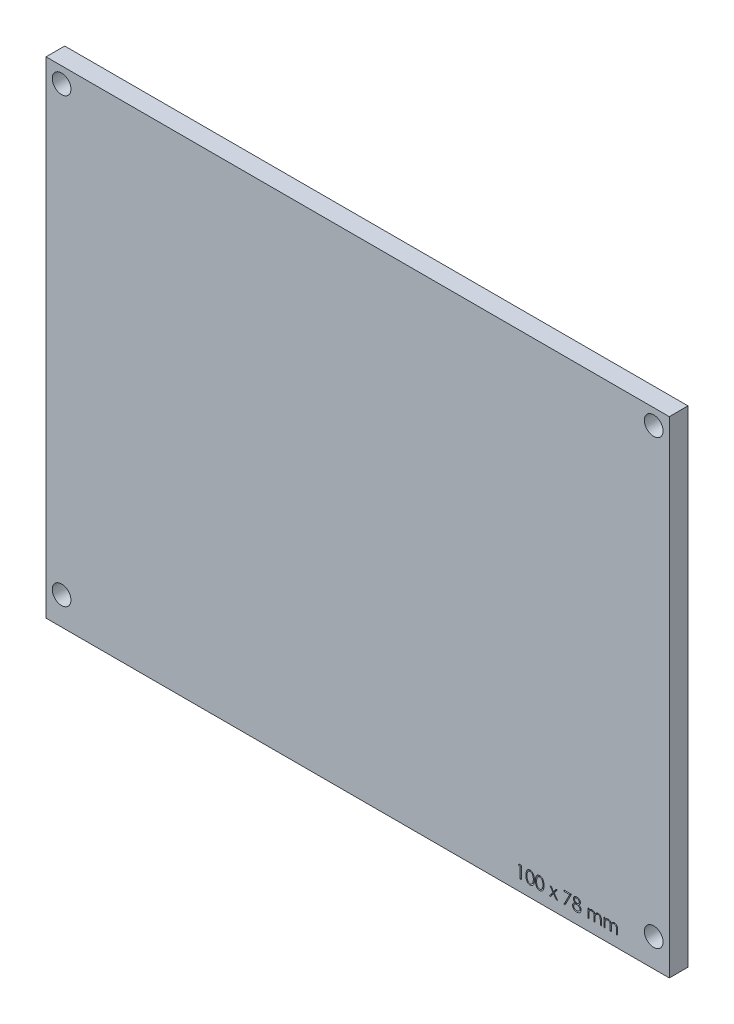
from build123d import *

# Parameters (mm, degrees)
SKETCH1_W               = 100
SKETCH1_H               = 78
BOSS_EXTRUDE1_DEPTH     = 3
CUT_EXTRUDE1_DEPTH      = 64.482280992
CUT_EXTRUDE1_DEPTH_BACK = 64.482280992
SKETCH2_R               = 1.5
CUT_EXTRUDE2_DEPTH      = 1


with BuildPart() as part:
    # Sketch1 → Boss-Extrude1 (new body)
    with BuildSketch(Plane.XY):
        Rectangle(SKETCH1_W, SKETCH1_H)
    extrude(amount=BOSS_EXTRUDE1_DEPTH)

    # Sketch2 → Cut-Extrude1 (cut, two sides: drawn at the far end of the back side and taken through both)
    with BuildSketch(Plane.XY.offset(3).offset(-CUT_EXTRUDE1_DEPTH_BACK)):
        with Locations((-47.5, 36.5)):
            Circle(SKETCH2_R)
        with Locations((47.5, 36.5)):
            Circle(SKETCH2_R)
        with Locations((47.5, -34.5)):
            Circle(SKETCH2_R)
        with Locations((-47.5, -34.5)):
            Circle(SKETCH2_R)
    extrude(amount=CUT_EXTRUDE1_DEPTH + CUT_EXTRUDE1_DEPTH_BACK, mode=Mode.SUBTRACT)

    # Sketch4 → Cut-Extrude2 (cut)
    # profile 1 of 8: a face of its own
    with BuildSketch(Plane.XY.offset(3)):
        Polygon((25.888230408, -35.213331847), (26.258022075, -35.213331847), (26.258022075, -37.213331847), (26.078534895, -37.213331847), (26.078534895, -35.418460052), (25.770842588, -35.418460052), align=None)
    # profile 2 of 8: a face of its own
    with BuildSketch(Plane.XY.offset(3)):
        with BuildLine():
            add(Edge.make_bspline(
                [(27.001611819, -36.214133129), (27.001799258, -36.182077479), (27.00216336, -36.119808916), (27.006213887, -36.029074835), (27.012942654, -35.94395467), (27.02216401, -35.864444347), (27.033385713, -35.790523338), (27.048365991, -35.722389191), (27.065401878, -35.659726559), (27.085146133, -35.602331103), (27.107424869, -35.549429558), (27.131673018, -35.500043729), (27.158852901, -35.454248339), (27.187411137, -35.411312459), (27.218503749, -35.371938919), (27.251245915, -35.335571683), (27.286915559, -35.303051254), (27.324300135, -35.273424796), (27.363738114, -35.247453669), (27.404105352, -35.224577819), (27.445679698, -35.205035037), (27.48857466, -35.189669074), (27.532404693, -35.176977161), (27.577323017, -35.168297763), (27.623403796, -35.162836672), (27.654507473, -35.162314576), (27.67028169, -35.162049796)],
                knots=[0, 0, 0, 0, 1.646270934, 3.197905019, 4.663502075, 6.030701355, 7.308322542, 8.50163776, 9.611534131, 10.641858119, 11.616356847, 12.558055219, 13.465016945, 14.349605745, 15.204443733, 16.039544428, 16.859896111, 17.680448484, 18.487036065, 19.28249412, 20.06191084, 20.843045899, 21.620316918, 22.403196591, 23.190181807, 24, 24, 24, 24], degree=3))
            add(Edge.make_bspline(
                [(27.67028169, -35.162049796), (27.686187678, -35.162328547), (27.717819683, -35.162882896), (27.764585612, -35.168210863), (27.810271144, -35.177051505), (27.854681509, -35.189577776), (27.898181502, -35.205118163), (27.940430877, -35.224596516), (27.981692067, -35.247270154), (28.021309374, -35.27391237), (28.059717726, -35.303616528), (28.095973704, -35.337195196), (28.130080611, -35.374309321), (28.162466499, -35.414561814), (28.192212555, -35.45872472), (28.220540231, -35.506029926), (28.24589568, -35.557304706), (28.270315494, -35.611693544), (28.291393772, -35.670701349), (28.310403055, -35.733995498), (28.325762466, -35.802323605), (28.338556336, -35.875327174), (28.348467705, -35.953274307), (28.355686357, -36.035997916), (28.359499549, -36.123552425), (28.360217664, -36.183414053), (28.360586178, -36.214133129)],
                knots=[0, 0, 0, 0, 0.810914788, 1.612654377, 2.396697861, 3.181598691, 3.963628158, 4.749916497, 5.551656086, 6.361998678, 7.18212741, 8.025565596, 8.878627764, 9.750805457, 10.657531673, 11.591944965, 12.560506719, 13.57287815, 14.630710178, 15.753379473, 16.941251878, 18.199788006, 19.531962791, 20.947069417, 22.433333509, 24, 24, 24, 24], degree=3))
            add(Edge.make_bspline(
                [(28.360586178, -36.214133129), (28.360213844, -36.244718219), (28.359488366, -36.30431202), (28.355729105, -36.391472578), (28.348324173, -36.473757174), (28.339061322, -36.551363152), (28.326232201, -36.623967506), (28.31045782, -36.691821477), (28.29294335, -36.755218089), (28.271323467, -36.813637981), (28.247660204, -36.867896109), (28.221914378, -36.918563051), (28.19433162, -36.966086646), (28.164280909, -37.010086502), (28.132250387, -37.050874306), (28.097554508, -37.08773009), (28.061171316, -37.121541903), (28.022649936, -37.151628547), (27.982414763, -37.177962721), (27.941295291, -37.201513493), (27.898561929, -37.220503604), (27.855183099, -37.236809342), (27.810538318, -37.249266743), (27.764683238, -37.257880375), (27.717851103, -37.263921431), (27.686193066, -37.264382277), (27.67028169, -37.264613898)],
                knots=[0, 0, 0, 0, 1.561518951, 3.042555995, 4.452378317, 5.7783523, 7.031515105, 8.214008947, 9.334062868, 10.386615937, 11.391082383, 12.354592575, 13.286541444, 14.194233754, 15.072674879, 15.931287219, 16.775624067, 17.606195743, 18.42308326, 19.229000347, 20.022332153, 20.807536673, 21.593273796, 22.3848459, 23.188221202, 24, 24, 24, 24], degree=3))
            add(Edge.make_bspline(
                [(27.67028169, -37.264613898), (27.654507911, -37.264347409), (27.623405097, -37.263821945), (27.577317997, -37.258385527), (27.532585172, -37.24964524), (27.488985884, -37.23740718), (27.446296446, -37.222427274), (27.405098568, -37.202910883), (27.364934178, -37.180434272), (27.325910431, -37.154836889), (27.288760625, -37.125510213), (27.253275708, -37.093073476), (27.220347125, -37.056717241), (27.189699071, -37.017015571), (27.16057102, -36.974333718), (27.133777093, -36.928088934), (27.108993748, -36.878464585), (27.086340324, -36.825140064), (27.066255374, -36.767337248), (27.048513826, -36.704394861), (27.034505736, -36.635757354), (27.022515476, -36.561976002), (27.0128444, -36.482733756), (27.006241929, -36.397987597), (27.002161177, -36.307790335), (27.00179828, -36.245921892), (27.001611819, -36.214133129)],
                knots=[0, 0, 0, 0, 0.810891512, 1.598919785, 2.382837074, 3.152667961, 3.926044502, 4.706494248, 5.493654104, 6.291793342, 7.103789334, 7.925228297, 8.761435821, 9.622817696, 10.50288917, 11.416980706, 12.369136599, 13.353924996, 14.394355917, 15.514179734, 16.714354668, 17.994756427, 19.357759367, 20.818452758, 22.365282078, 24, 24, 24, 24], degree=3))
        make_face()
        with BuildLine():
            add(Edge.make_bspline(
                [(27.181098998, -36.213331847), (27.181167254, -36.240045389), (27.181299724, -36.291891129), (27.18476041, -36.367230135), (27.189474828, -36.437498895), (27.19555557, -36.50278663), (27.204585826, -36.562872351), (27.21470399, -36.618169313), (27.227017184, -36.668384877), (27.241585766, -36.713863626), (27.258179536, -36.755377379), (27.276297172, -36.794006645), (27.295760442, -36.830207752), (27.317542814, -36.863655528), (27.341265707, -36.89445905), (27.366393284, -36.923163526), (27.393863332, -36.948761801), (27.431865471, -36.979462861), (27.482034885, -37.01118808), (27.545246573, -37.038814417), (27.610199974, -37.056175821), (27.654286403, -37.058383681), (27.676291306, -37.059485693)],
                knots=[0, 0, 0, 0, 1.459021318, 2.831673884, 4.118529203, 5.306027144, 6.411944654, 7.436330062, 8.375795394, 9.233974572, 10.042671642, 10.816086306, 11.563610507, 12.285937304, 12.993564865, 13.685989202, 14.367179055, 15.041617293, 16.353048772, 17.594441528, 18.799311195, 20, 20, 20, 20], degree=3))
            add(Edge.make_bspline(
                [(27.676291306, -37.059485693), (27.698438547, -37.058572675), (27.742687303, -37.056748525), (27.807335186, -37.039149247), (27.87009534, -37.012595224), (27.919279306, -36.98119665), (27.956697902, -36.951294747), (27.983507611, -36.925800662), (28.008114496, -36.897254453), (28.031452824, -36.866454855), (28.05285801, -36.832813435), (28.07232266, -36.796491964), (28.090084573, -36.757389576), (28.100204028, -36.730092583), (28.105377844, -36.716136334)],
                knots=[0, 0, 0, 0, 1.353760809, 2.704726607, 4.075137775, 5.516104923, 6.260822281, 7.007110065, 7.778089737, 8.566572457, 9.372053459, 10.217411131, 11.088608312, 12, 12, 12, 12], degree=3))
            add(Edge.make_bspline(
                [(28.105377844, -36.716136334), (28.111407426, -36.698290769), (28.123650062, -36.662056618), (28.139428219, -36.605848817), (28.151854161, -36.546875809), (28.163033228, -36.485490028), (28.170663545, -36.42123877), (28.176805153, -36.354320836), (28.180422688, -36.284685772), (28.180871117, -36.237374349), (28.181098998, -36.213331847)],
                knots=[0, 0, 0, 0, 0.884706709, 1.796334032, 2.740027952, 3.714592787, 4.726048262, 5.777819803, 6.87074269, 8, 8, 8, 8], degree=3))
            add(Edge.make_bspline(
                [(28.181098998, -36.213331847), (28.180784604, -36.189293234), (28.180169583, -36.142268568), (28.177818733, -36.073401037), (28.171748119, -36.007990888), (28.165005765, -35.945756332), (28.155064496, -35.887041873), (28.144345749, -35.831355984), (28.129945056, -35.779388542), (28.114562328, -35.730325924), (28.096956387, -35.68472555), (28.077575968, -35.642374814), (28.05687782, -35.603069257), (28.03439654, -35.566916719), (28.010399006, -35.533755266), (27.984251835, -35.504249784), (27.956992194, -35.477485802), (27.918810945, -35.446935762), (27.868825636, -35.415786222), (27.806628124, -35.387120074), (27.741902041, -35.370658192), (27.698145782, -35.368337228), (27.676291306, -35.367178001)],
                knots=[0, 0, 0, 0, 1.31362396, 2.569729283, 3.763502607, 4.902122613, 5.988968491, 7.01645872, 7.998833611, 8.933434873, 9.825090667, 10.667526885, 11.477055099, 12.250526234, 12.991942729, 13.710640831, 14.402115721, 15.076753259, 16.378508321, 17.609869233, 18.806226677, 20, 20, 20, 20], degree=3))
            add(Edge.make_bspline(
                [(27.676291306, -35.367178001), (27.654170967, -35.368338827), (27.609889993, -35.370662596), (27.544491161, -35.38705874), (27.481802961, -35.415637578), (27.431949832, -35.447038934), (27.393741954, -35.47694654), (27.366837558, -35.502881657), (27.341611174, -35.531250945), (27.318372488, -35.562337754), (27.296607183, -35.595746535), (27.276618033, -35.631740115), (27.258608131, -35.670500894), (27.241988396, -35.711996), (27.227375374, -35.757470826), (27.215321681, -35.807624536), (27.204186222, -35.862745617), (27.196303211, -35.923156765), (27.189295351, -35.988460852), (27.184791723, -36.058905034), (27.181288147, -36.134370394), (27.181163311, -36.186484199), (27.181098998, -36.213331847)],
                knots=[0, 0, 0, 0, 1.207732386, 2.417664972, 3.655092373, 4.956220595, 5.625982001, 6.301752483, 6.994047911, 7.697131622, 8.419323945, 9.170223765, 9.943494443, 10.752040957, 11.610060368, 12.549350801, 13.567764191, 14.679664412, 15.874934091, 17.154273443, 18.533957287, 20, 20, 20, 20], degree=3))
        make_face(mode=Mode.SUBTRACT)
    # profile 3 of 8: a face of its own
    with BuildSketch(Plane.XY.offset(3)):
        with BuildLine():
            add(Edge.make_bspline(
                [(28.540073357, -36.214133129), (28.540260796, -36.182077479), (28.540624899, -36.119808916), (28.544675425, -36.029074835), (28.551404192, -35.94395467), (28.560625548, -35.864444347), (28.571847251, -35.790523338), (28.586827529, -35.722389191), (28.603863416, -35.659726559), (28.623607671, -35.602331103), (28.645886408, -35.549429558), (28.670134557, -35.500043729), (28.697314439, -35.454248339), (28.725872675, -35.411312459), (28.756965287, -35.371938919), (28.789707453, -35.335571683), (28.825377097, -35.303051254), (28.862761673, -35.273424796), (28.902199653, -35.247453669), (28.942566891, -35.224577819), (28.984141237, -35.205035037), (29.027036198, -35.189669074), (29.070866232, -35.176977161), (29.115784555, -35.168297763), (29.161865335, -35.162836672), (29.192969012, -35.162314576), (29.208743229, -35.162049796)],
                knots=[0, 0, 0, 0, 1.646270934, 3.197905019, 4.663502075, 6.030701355, 7.308322542, 8.50163776, 9.611534131, 10.641858119, 11.616356847, 12.558055219, 13.465016945, 14.349605745, 15.204443733, 16.039544428, 16.859896111, 17.680448484, 18.487036065, 19.28249412, 20.06191084, 20.843045899, 21.620316918, 22.403196591, 23.190181807, 24, 24, 24, 24], degree=3))
            add(Edge.make_bspline(
                [(29.208743229, -35.162049796), (29.224649217, -35.162328547), (29.256281222, -35.162882896), (29.30304715, -35.168210863), (29.348732683, -35.177051505), (29.393143048, -35.189577776), (29.43664304, -35.205118163), (29.478892416, -35.224596516), (29.520153605, -35.247270154), (29.559770912, -35.27391237), (29.598179264, -35.303616528), (29.634435243, -35.337195196), (29.668542149, -35.374309321), (29.700928038, -35.414561814), (29.730674093, -35.45872472), (29.759001769, -35.506029926), (29.784357218, -35.557304706), (29.808777032, -35.611693544), (29.829855311, -35.670701349), (29.848864594, -35.733995498), (29.864224004, -35.802323605), (29.877017874, -35.875327174), (29.886929243, -35.953274307), (29.894147896, -36.035997916), (29.897961087, -36.123552425), (29.898679202, -36.183414053), (29.899047716, -36.214133129)],
                knots=[0, 0, 0, 0, 0.810914788, 1.612654377, 2.396697861, 3.181598691, 3.963628158, 4.749916497, 5.551656086, 6.361998678, 7.18212741, 8.025565596, 8.878627764, 9.750805457, 10.657531673, 11.591944965, 12.560506719, 13.57287815, 14.630710178, 15.753379473, 16.941251878, 18.199788006, 19.531962791, 20.947069417, 22.433333509, 24, 24, 24, 24], degree=3))
            add(Edge.make_bspline(
                [(29.899047716, -36.214133129), (29.898675382, -36.244718219), (29.897949904, -36.30431202), (29.894190643, -36.391472578), (29.886785711, -36.473757174), (29.877522861, -36.551363152), (29.864693739, -36.623967506), (29.848919358, -36.691821477), (29.831404888, -36.755218089), (29.809785006, -36.813637981), (29.786121743, -36.867896109), (29.760375916, -36.918563051), (29.732793159, -36.966086646), (29.702742447, -37.010086502), (29.670711925, -37.050874306), (29.636016046, -37.08773009), (29.599632855, -37.121541903), (29.561111474, -37.151628547), (29.520876302, -37.177962721), (29.479756829, -37.201513493), (29.437023467, -37.220503604), (29.393644637, -37.236809342), (29.348999857, -37.249266743), (29.303144776, -37.257880375), (29.256312641, -37.263921431), (29.224654604, -37.264382277), (29.208743229, -37.264613898)],
                knots=[0, 0, 0, 0, 1.561518951, 3.042555995, 4.452378317, 5.7783523, 7.031515105, 8.214008947, 9.334062868, 10.386615937, 11.391082383, 12.354592575, 13.286541444, 14.194233754, 15.072674879, 15.931287219, 16.775624067, 17.606195743, 18.42308326, 19.229000347, 20.022332153, 20.807536673, 21.593273796, 22.3848459, 23.188221202, 24, 24, 24, 24], degree=3))
            add(Edge.make_bspline(
                [(29.208743229, -37.264613898), (29.192969449, -37.264347409), (29.161866635, -37.263821945), (29.115779535, -37.258385527), (29.07104671, -37.24964524), (29.027447422, -37.23740718), (28.984757985, -37.222427274), (28.943560107, -37.202910883), (28.903395716, -37.180434272), (28.86437197, -37.154836889), (28.827222164, -37.125510213), (28.791737246, -37.093073476), (28.758808664, -37.056717241), (28.728160609, -37.017015571), (28.699032559, -36.974333718), (28.672238631, -36.928088934), (28.647455286, -36.878464585), (28.624801863, -36.825140064), (28.604716912, -36.767337248), (28.586975365, -36.704394861), (28.572967275, -36.635757354), (28.560977015, -36.561976002), (28.551305939, -36.482733756), (28.544703467, -36.397987597), (28.540622716, -36.307790335), (28.540259818, -36.245921892), (28.540073357, -36.214133129)],
                knots=[0, 0, 0, 0, 0.810891512, 1.598919785, 2.382837074, 3.152667961, 3.926044502, 4.706494248, 5.493654104, 6.291793342, 7.103789334, 7.925228297, 8.761435821, 9.622817696, 10.50288917, 11.416980706, 12.369136599, 13.353924996, 14.394355917, 15.514179734, 16.714354668, 17.994756427, 19.357759367, 20.818452758, 22.365282078, 24, 24, 24, 24], degree=3))
        make_face()
        with BuildLine():
            add(Edge.make_bspline(
                [(28.719560537, -36.213331847), (28.719628792, -36.240045389), (28.719761262, -36.291891129), (28.723221948, -36.367230135), (28.727936367, -36.437498895), (28.734017108, -36.50278663), (28.743047364, -36.562872351), (28.753165529, -36.618169313), (28.765478723, -36.668384877), (28.780047304, -36.713863626), (28.796641074, -36.755377379), (28.814758711, -36.794006645), (28.834221981, -36.830207752), (28.856004352, -36.863655528), (28.879727246, -36.89445905), (28.904854822, -36.923163526), (28.932324871, -36.948761801), (28.970327009, -36.979462861), (29.020496423, -37.01118808), (29.083708112, -37.038814417), (29.148661512, -37.056175821), (29.192747941, -37.058383681), (29.214752844, -37.059485693)],
                knots=[0, 0, 0, 0, 1.459021318, 2.831673884, 4.118529203, 5.306027144, 6.411944654, 7.436330062, 8.375795394, 9.233974572, 10.042671642, 10.816086306, 11.563610507, 12.285937304, 12.993564865, 13.685989202, 14.367179055, 15.041617293, 16.353048772, 17.594441528, 18.799311195, 20, 20, 20, 20], degree=3))
            add(Edge.make_bspline(
                [(29.214752844, -37.059485693), (29.236900085, -37.058572675), (29.281148841, -37.056748525), (29.345796724, -37.039149247), (29.408556879, -37.012595224), (29.457740844, -36.98119665), (29.495159441, -36.951294747), (29.521969149, -36.925800662), (29.546576034, -36.897254453), (29.569914363, -36.866454855), (29.591319549, -36.832813435), (29.610784199, -36.796491964), (29.628546112, -36.757389576), (29.638665567, -36.730092583), (29.643839383, -36.716136334)],
                knots=[0, 0, 0, 0, 1.353760809, 2.704726607, 4.075137775, 5.516104923, 6.260822281, 7.007110065, 7.778089737, 8.566572457, 9.372053459, 10.217411131, 11.088608312, 12, 12, 12, 12], degree=3))
            add(Edge.make_bspline(
                [(29.643839383, -36.716136334), (29.649868964, -36.698290769), (29.662111601, -36.662056618), (29.677889757, -36.605848817), (29.6903157, -36.546875809), (29.701494766, -36.485490028), (29.709125084, -36.42123877), (29.715266691, -36.354320836), (29.718884227, -36.284685772), (29.719332656, -36.237374349), (29.719560537, -36.213331847)],
                knots=[0, 0, 0, 0, 0.884706709, 1.796334032, 2.740027952, 3.714592787, 4.726048262, 5.777819803, 6.87074269, 8, 8, 8, 8], degree=3))
            add(Edge.make_bspline(
                [(29.719560537, -36.213331847), (29.719246143, -36.189293234), (29.718631121, -36.142268568), (29.716280271, -36.073401037), (29.710209657, -36.007990888), (29.703467303, -35.945756332), (29.693526034, -35.887041873), (29.682807287, -35.831355984), (29.668406595, -35.779388542), (29.653023866, -35.730325924), (29.635417926, -35.68472555), (29.616037506, -35.642374814), (29.595339358, -35.603069257), (29.572858078, -35.566916719), (29.548860545, -35.533755266), (29.522713374, -35.504249784), (29.495453732, -35.477485802), (29.457272483, -35.446935762), (29.407287175, -35.415786222), (29.345089662, -35.387120074), (29.28036358, -35.370658192), (29.23660732, -35.368337228), (29.214752844, -35.367178001)],
                knots=[0, 0, 0, 0, 1.31362396, 2.569729283, 3.763502607, 4.902122613, 5.988968491, 7.01645872, 7.998833611, 8.933434873, 9.825090667, 10.667526885, 11.477055099, 12.250526234, 12.991942729, 13.710640831, 14.402115721, 15.076753259, 16.378508321, 17.609869233, 18.806226677, 20, 20, 20, 20], degree=3))
            add(Edge.make_bspline(
                [(29.214752844, -35.367178001), (29.192632506, -35.368338827), (29.148351531, -35.370662596), (29.0829527, -35.38705874), (29.020264499, -35.415637578), (28.970411371, -35.447038934), (28.932203493, -35.47694654), (28.905299096, -35.502881657), (28.880072712, -35.531250945), (28.856834026, -35.562337754), (28.835068722, -35.595746535), (28.815079572, -35.631740115), (28.797069669, -35.670500894), (28.780449934, -35.711996), (28.765836912, -35.757470826), (28.753783219, -35.807624536), (28.74264776, -35.862745617), (28.734764749, -35.923156765), (28.727756889, -35.988460852), (28.723253262, -36.058905034), (28.719749686, -36.134370394), (28.719624849, -36.186484199), (28.719560537, -36.213331847)],
                knots=[0, 0, 0, 0, 1.207732386, 2.417664972, 3.655092373, 4.956220595, 5.625982001, 6.301752483, 6.994047911, 7.697131622, 8.419323945, 9.170223765, 9.943494443, 10.752040957, 11.610060368, 12.549350801, 13.567764191, 14.679664412, 15.874934091, 17.154273443, 18.533957287, 20, 20, 20, 20], degree=3))
        make_face(mode=Mode.SUBTRACT)
    # profile 4 of 8: a face of its own
    with BuildSketch(Plane.XY.offset(3)):
        Polygon((30.847765665, -35.751793385), (31.061307331, -35.751793385), (31.437509254, -36.279036975), (31.813711178, -35.751793385), (32.027252844, -35.751793385), (31.544480408, -36.428476078), (32.104175921, -37.213331847), (31.890634254, -37.213331847), (31.437509254, -36.578315821), (30.984384254, -37.213331847), (30.770842588, -37.213331847), (31.330938742, -36.428476078), align=None)
    # profile 5 of 8: a face of its own
    with BuildSketch(Plane.XY.offset(3)):
        Polygon((33.078534895, -35.213331847), (34.309304126, -35.213331847), (33.258022075, -37.264613898), (33.102973998, -37.17927736), (34.005618229, -35.418460052), (33.078534895, -35.418460052), align=None)
    # profile 6 of 8: a face of its own
    with BuildSketch(Plane.XY.offset(3)):
        with BuildLine():
            add(Edge.make_bspline(
                [(35.461147075, -36.099149155), (35.477517673, -36.107685129), (35.509445807, -36.124333131), (35.554918498, -36.151139318), (35.596475641, -36.179391298), (35.635270248, -36.207754647), (35.670620734, -36.23731559), (35.702131827, -36.268191679), (35.730581896, -36.29961222), (35.755397201, -36.332109271), (35.777223965, -36.365596499), (35.796088042, -36.400161798), (35.812212158, -36.435729417), (35.82499098, -36.472687606), (35.835517718, -36.51049347), (35.842760921, -36.549635174), (35.846656303, -36.589854797), (35.847392768, -36.617036684), (35.847765665, -36.630799796)],
                knots=[0, 0, 0, 0, 1.272397273, 2.481599622, 3.635517121, 4.734568067, 5.792894095, 6.808321871, 7.773003508, 8.711915296, 9.623354172, 10.525449501, 11.423591555, 12.311487226, 13.218079475, 14.126165749, 15.051214107, 16, 16, 16, 16], degree=3))
            add(Edge.make_bspline(
                [(35.847765665, -36.630799796), (35.847324853, -36.650055643), (35.846452321, -36.68817019), (35.83885233, -36.74442511), (35.827473485, -36.799060414), (35.810856621, -36.852064123), (35.789306112, -36.903143765), (35.76274792, -36.952343064), (35.732684374, -37.000468384), (35.708540238, -37.030079471), (35.696323357, -37.045062616)],
                knots=[0, 0, 0, 0, 1.025265484, 2.029385089, 3.018602448, 3.995076438, 4.983346944, 5.966715145, 6.97116228, 8, 8, 8, 8], degree=3))
            add(Edge.make_bspline(
                [(35.696323357, -37.045062616), (35.6804168, -37.062544773), (35.648800249, -37.097293054), (35.594638576, -37.142407803), (35.535197499, -37.180321742), (35.470707023, -37.211219968), (35.401339537, -37.23526903), (35.32710982, -37.252550469), (35.247873161, -37.262449), (35.193412892, -37.263879851), (35.165473998, -37.264613898)],
                knots=[0, 0, 0, 0, 0.954267603, 1.896743057, 2.838368354, 3.796610408, 4.779680527, 5.799409237, 6.871065594, 8, 8, 8, 8], degree=3))
            add(Edge.make_bspline(
                [(35.165473998, -37.264613898), (35.138609205, -37.263955339), (35.086333045, -37.262673851), (35.010242829, -37.253991318), (34.939315361, -37.238775395), (34.873138236, -37.217949904), (34.812110411, -37.190858345), (34.756405782, -37.157139254), (34.705220655, -37.118149858), (34.660108385, -37.072770385), (34.620057845, -37.024165887), (34.584876101, -36.97402211), (34.55563377, -36.922334477), (34.53087543, -36.869873695), (34.511922274, -36.815904465), (34.498795297, -36.760704457), (34.490458546, -36.70437009), (34.489349326, -36.666352002), (34.488791306, -36.647226078)],
                knots=[0, 0, 0, 0, 1.256902934, 2.445805442, 3.576955095, 4.645999104, 5.686449165, 6.692658513, 7.68621702, 8.689161843, 9.678783111, 10.630372946, 11.551080876, 12.453998257, 13.34127905, 14.221779781, 15.105423033, 16, 16, 16, 16], degree=3))
            add(Edge.make_bspline(
                [(34.488791306, -36.647226078), (34.489121523, -36.633192254), (34.48977415, -36.605456464), (34.494291206, -36.564479705), (34.501553184, -36.524596199), (34.511415731, -36.485658632), (34.524782032, -36.447950476), (34.540920394, -36.411293062), (34.559738652, -36.375645006), (34.581499318, -36.34081136), (34.60681476, -36.30728021), (34.635479703, -36.274482498), (34.668067056, -36.242927146), (34.70421429, -36.212228617), (34.743508313, -36.181842347), (34.786969759, -36.153410502), (34.833446483, -36.124920236), (34.866478143, -36.107886907), (34.883422716, -36.099149155)],
                knots=[0, 0, 0, 0, 0.941657376, 1.861047343, 2.762797495, 3.66048619, 4.553285746, 5.444104102, 6.34607688, 7.256116206, 8.197091036, 9.162375105, 10.176350973, 11.237807142, 12.343728897, 13.50695164, 14.721116704, 16, 16, 16, 16], degree=3))
            add(Edge.make_bspline(
                [(34.883422716, -36.099149155), (34.860227645, -36.086500715), (34.815315495, -36.062009797), (34.755847242, -36.017011622), (34.704766886, -35.968275728), (34.663478476, -35.914772988), (34.63098006, -35.858174774), (34.608683715, -35.798835201), (34.593600009, -35.737854565), (34.592105823, -35.696193881), (34.591355408, -35.67527095)],
                knots=[0, 0, 0, 0, 1.166880483, 2.259407225, 3.286803203, 4.280235371, 5.237608625, 6.161067461, 7.076446754, 8, 8, 8, 8], degree=3))
            add(Edge.make_bspline(
                [(34.591355408, -35.67527095), (34.592289936, -35.653958059), (34.594168501, -35.611115432), (34.60935897, -35.547340505), (34.634113293, -35.484702467), (34.667782435, -35.423504917), (34.709717987, -35.36581908), (34.760030298, -35.314081397), (34.817517897, -35.26876055), (34.881893821, -35.230717022), (34.95117167, -35.199754932), (35.024266369, -35.178395833), (35.099904365, -35.164432338), (35.151388776, -35.162851392), (35.177493229, -35.162049796)],
                knots=[0, 0, 0, 0, 0.888701115, 1.786444228, 2.72001202, 3.692817113, 4.693886446, 5.687152267, 6.695133018, 7.739871481, 8.800368666, 9.853104506, 10.91144658, 12, 12, 12, 12], degree=3))
            add(Edge.make_bspline(
                [(35.177493229, -35.162049796), (35.20292398, -35.162876277), (35.253070525, -35.164506005), (35.326781741, -35.178098507), (35.397310242, -35.20080109), (35.464412813, -35.231599503), (35.526888166, -35.269534898), (35.582089485, -35.315478255), (35.630850961, -35.366987712), (35.6711849, -35.424656057), (35.704420837, -35.485618453), (35.727564209, -35.549402751), (35.742393909, -35.614630784), (35.744264402, -35.658766787), (35.745201562, -35.680879924)],
                knots=[0, 0, 0, 0, 1.072916533, 2.115669174, 3.151510826, 4.193348718, 5.225979165, 6.227137561, 7.216255879, 8.211077061, 9.189680878, 10.138522389, 11.067357538, 12, 12, 12, 12], degree=3))
            add(Edge.make_bspline(
                [(35.745201562, -35.680879924), (35.744381813, -35.702580875), (35.742771873, -35.745200309), (35.72922905, -35.807329749), (35.706421443, -35.865513771), (35.675281921, -35.920412601), (35.634695928, -35.9710306), (35.585205223, -36.018011439), (35.527204379, -36.061741056), (35.483626729, -36.086418978), (35.461147075, -36.099149155)],
                knots=[0, 0, 0, 0, 0.975232327, 1.915300861, 2.843280834, 3.77672583, 4.742871857, 5.749627742, 6.839139064, 8, 8, 8, 8], degree=3))
        make_face()
        with BuildLine():
            add(Edge.make_bspline(
                [(35.167477203, -35.367178001), (35.153448171, -35.367550253), (35.126001251, -35.36827854), (35.085756296, -35.372083475), (35.047486371, -35.379485313), (35.010791628, -35.389336006), (34.976175164, -35.402643427), (34.943166847, -35.418297718), (34.912328453, -35.437329756), (34.883287709, -35.458679012), (34.857144409, -35.482160672), (34.833941808, -35.506625655), (34.8146686, -35.53255445), (34.798302251, -35.559302084), (34.786427099, -35.587662413), (34.777533211, -35.616765943), (34.771520987, -35.646980448), (34.771070478, -35.667629883), (34.770842588, -35.678075437)],
                knots=[0, 0, 0, 0, 1.203892937, 2.355340988, 3.463153438, 4.544400666, 5.610487187, 6.640501085, 7.674077295, 8.714426146, 9.728707835, 10.68524104, 11.601827946, 12.495867327, 13.368432065, 14.231010473, 15.105153427, 16, 16, 16, 16], degree=3))
            add(Edge.make_bspline(
                [(34.770842588, -35.678075437), (34.771235369, -35.688521442), (34.772011561, -35.70916425), (34.778014491, -35.739647602), (34.786961265, -35.769602823), (34.801047357, -35.798317629), (34.817942419, -35.82678812), (34.838794691, -35.85430274), (34.863645564, -35.880957246), (34.891661245, -35.906524927), (34.922182123, -35.930467077), (34.954515862, -35.951251752), (34.988256657, -35.968642672), (35.02305784, -35.983116618), (35.059274096, -35.994368011), (35.096683509, -36.002350094), (35.135292367, -36.007311236), (35.161452699, -36.007903819), (35.174688742, -36.008203642)],
                knots=[0, 0, 0, 0, 0.873023192, 1.725219244, 2.590779336, 3.480155217, 4.391973325, 5.357036234, 6.360879153, 7.436073238, 8.526419356, 9.601555421, 10.645666583, 11.697338044, 12.750135903, 13.812665442, 14.89329948, 16, 16, 16, 16], degree=3))
            add(Edge.make_bspline(
                [(35.174688742, -36.008203642), (35.191688801, -36.007704861), (35.225521011, -36.006712225), (35.275394915, -35.997482982), (35.323887854, -35.982965315), (35.370481514, -35.963102477), (35.413969849, -35.938172272), (35.452735602, -35.908324833), (35.486448112, -35.874249349), (35.514757032, -35.8364763), (35.536705516, -35.796275392), (35.553792263, -35.755932368), (35.5637701, -35.715016807), (35.565071567, -35.687607113), (35.565714383, -35.674069026)],
                knots=[0, 0, 0, 0, 1.076279235, 2.141928126, 3.20205304, 4.278698113, 5.344010996, 6.36967002, 7.368914609, 8.37248503, 9.349703398, 10.264243087, 11.142681841, 12, 12, 12, 12], degree=3))
            add(Edge.make_bspline(
                [(35.565714383, -35.674069026), (35.565410441, -35.664567292), (35.564807161, -35.64570771), (35.5598357, -35.617857215), (35.551620939, -35.590640311), (35.540499179, -35.563832156), (35.52586501, -35.53780888), (35.508514046, -35.512161402), (35.487437188, -35.487466679), (35.463782083, -35.463149223), (35.436956135, -35.440644067), (35.407011043, -35.420852804), (35.374100328, -35.404045743), (35.338223214, -35.390395026), (35.299511829, -35.380142255), (35.258144472, -35.372464342), (35.213776216, -35.368136849), (35.18324493, -35.367504549), (35.167477203, -35.367178001)],
                knots=[0, 0, 0, 0, 0.814439003, 1.616544685, 2.417341072, 3.248991801, 4.09997495, 4.973547432, 5.9003056, 6.880240646, 7.880314356, 8.896779544, 9.951930927, 11.043077905, 12.18215768, 13.381699519, 14.647792085, 16, 16, 16, 16], degree=3))
        make_face(mode=Mode.SUBTRACT)
        with BuildLine():
            add(Edge.make_bspline(
                [(35.179095793, -36.213331847), (35.16130963, -36.213648213), (35.126417517, -36.214268847), (35.075299273, -36.221177133), (35.026240321, -36.230793929), (34.979406072, -36.24538298), (34.934816302, -36.264352403), (34.892229626, -36.28717214), (34.851971838, -36.314146679), (34.814598852, -36.344933316), (34.780471235, -36.378110147), (34.750529349, -36.413231367), (34.725102194, -36.449644243), (34.704626051, -36.487811231), (34.687819347, -36.526924152), (34.676782846, -36.567957063), (34.669707582, -36.610121128), (34.668757507, -36.638784041), (34.668278485, -36.653235693)],
                knots=[0, 0, 0, 0, 1.140299081, 2.23698856, 3.303958914, 4.344563908, 5.37730929, 6.408454204, 7.439741482, 8.480804886, 9.510774543, 10.48932336, 11.43758569, 12.353841022, 13.263987381, 14.161954604, 15.073269652, 16, 16, 16, 16], degree=3))
            add(Edge.make_bspline(
                [(34.668278485, -36.653235693), (34.66905749, -36.671196211), (34.670603018, -36.706829459), (34.682863954, -36.759494071), (34.702541403, -36.810477531), (34.729984384, -36.859364361), (34.763965854, -36.905050136), (34.805752407, -36.944872293), (34.852747171, -36.980255995), (34.906540231, -37.008873443), (34.965299354, -37.031727646), (35.029008914, -37.04747391), (35.096754582, -37.057897596), (35.143531491, -37.058947985), (35.167477203, -37.059485693)],
                knots=[0, 0, 0, 0, 0.898778495, 1.783155532, 2.693654817, 3.627872908, 4.583023416, 5.533784346, 6.509005473, 7.520592997, 8.575161974, 9.658835044, 10.801527049, 12, 12, 12, 12], degree=3))
            add(Edge.make_bspline(
                [(35.167477203, -37.059485693), (35.186191699, -37.059126374), (35.222653539, -37.058426305), (35.275845509, -37.052246708), (35.326042394, -37.042446923), (35.37314685, -37.028193468), (35.417686188, -37.010793482), (35.458905247, -36.988409435), (35.497864405, -36.962950965), (35.532643904, -36.932746304), (35.564320023, -36.900472307), (35.591939048, -36.866306568), (35.615914791, -36.831177635), (35.63473248, -36.794291644), (35.649776054, -36.756356264), (35.660589514, -36.717021686), (35.667261637, -36.676167267), (35.667936434, -36.648453512), (35.668278485, -36.634405565)],
                knots=[0, 0, 0, 0, 1.224942928, 2.386581632, 3.501229538, 4.569074225, 5.605009692, 6.626002462, 7.634866581, 8.645888296, 9.63523824, 10.59253846, 11.518950513, 12.414518923, 13.29783783, 14.186679152, 15.080837789, 16, 16, 16, 16], degree=3))
            add(Edge.make_bspline(
                [(35.668278485, -36.634405565), (35.667760857, -36.62076137), (35.666740186, -36.593857402), (35.660262077, -36.553990815), (35.648881575, -36.515474921), (35.63326592, -36.477846347), (35.612476799, -36.441867518), (35.587994016, -36.406601134), (35.558454519, -36.373026023), (35.525075893, -36.340881396), (35.488699344, -36.311158118), (35.450032404, -36.284864153), (35.409372711, -36.262720087), (35.366806305, -36.244710661), (35.322427702, -36.230546393), (35.276269543, -36.220651538), (35.228277786, -36.214423194), (35.195675002, -36.213699739), (35.179095793, -36.213331847)],
                knots=[0, 0, 0, 0, 0.917430815, 1.809013306, 2.70690318, 3.612392954, 4.541220862, 5.495268465, 6.494511384, 7.542276156, 8.608045339, 9.649016899, 10.681629292, 11.715607085, 12.752076957, 13.808767841, 14.885711793, 16, 16, 16, 16], degree=3))
        make_face(mode=Mode.SUBTRACT)
    # profile 7 of 8: a face of its own
    with BuildSketch(Plane.XY.offset(3)):
        with BuildLine():
            Line((36.924688742, -35.751793385), (37.104175921, -35.751793385))
            Line((37.104175921, -35.751793385), (37.104175921, -36.005799796))
            add(Edge.make_bspline(
                [(37.104175921, -36.005799796), (37.120338178, -35.983578309), (37.151306612, -35.94099981), (37.202086985, -35.884891076), (37.252816192, -35.837274988), (37.289349553, -35.812279061), (37.30690028, -35.80027095)],
                knots=[0, 0, 0, 0, 1.134379233, 2.173579362, 3.122582517, 4, 4, 4, 4], degree=3))
            add(Edge.make_bspline(
                [(37.30690028, -35.80027095), (37.330822944, -35.788839312), (37.378250315, -35.766175762), (37.453347015, -35.743185157), (37.530189684, -35.729056527), (37.582080092, -35.727124314), (37.608182331, -35.72615236)],
                knots=[0, 0, 0, 0, 1.014936303, 2.012140481, 3.000054389, 4, 4, 4, 4], degree=3))
            add(Edge.make_bspline(
                [(37.608182331, -35.72615236), (37.625835472, -35.726749669), (37.660770089, -35.727931711), (37.712532426, -35.73562316), (37.762737347, -35.748918116), (37.811088221, -35.767436587), (37.856642895, -35.789863265), (37.898408151, -35.816177384), (37.935907698, -35.84571857), (37.969122585, -35.879820817), (37.998990599, -35.919441731), (38.026464226, -35.965649873), (38.051850062, -36.019482822), (38.065919381, -36.058549417), (38.073326562, -36.079117103)],
                knots=[0, 0, 0, 0, 1.009824226, 1.998387844, 2.986035974, 3.974953746, 4.955485308, 5.885931332, 6.793869504, 7.679848016, 8.601185859, 9.625726857, 10.749998409, 12, 12, 12, 12], degree=3))
            add(Edge.make_bspline(
                [(38.073326562, -36.079117103), (38.081161563, -36.064988864), (38.096579744, -36.037186472), (38.12246868, -35.997838894), (38.149593135, -35.961035013), (38.178184274, -35.926745628), (38.20814118, -35.895140067), (38.239604838, -35.866113838), (38.272396141, -35.839542287), (38.317991707, -35.808500482), (38.377313197, -35.775528378), (38.452106405, -35.746940696), (38.529906503, -35.729274337), (38.582716617, -35.727199895), (38.609384254, -35.72615236)],
                knots=[0, 0, 0, 0, 0.86119277, 1.694706429, 2.50939023, 3.298075842, 4.073795165, 4.829715201, 5.57930267, 6.321991688, 7.768977793, 9.186738141, 10.579381044, 12, 12, 12, 12], degree=3))
            add(Edge.make_bspline(
                [(38.609384254, -35.72615236), (38.633887947, -35.727076486), (38.681844054, -35.728885091), (38.751659634, -35.743087075), (38.816769237, -35.767474302), (38.877041852, -35.800750666), (38.931418889, -35.842567342), (38.978685351, -35.892320964), (39.01855413, -35.949659606), (39.044599067, -36.003597885), (39.062264932, -36.051218075), (39.073157066, -36.091793099), (39.082779749, -36.136451129), (39.090769032, -36.185245564), (39.096608205, -36.238348769), (39.100934328, -36.295673841), (39.10386237, -36.357265333), (39.104069268, -36.399759905), (39.104175921, -36.42166518)],
                knots=[0, 0, 0, 0, 1.209669288, 2.367440248, 3.500751976, 4.631527125, 5.755587489, 6.87532382, 8.007944318, 9.190864318, 9.82315674, 10.514484317, 11.263564316, 12.079023757, 12.955305781, 13.901327259, 14.918167583, 16, 16, 16, 16], degree=3))
            Line((39.104175921, -36.42166518), (39.104175921, -37.213331847))
            Line((39.104175921, -37.213331847), (38.924688742, -37.213331847))
            Line((38.924688742, -37.213331847), (38.924688742, -36.420863898))
            add(Edge.make_bspline(
                [(38.924688742, -36.420863898), (38.924644237, -36.402166427), (38.924558706, -36.366232732), (38.923019488, -36.314659903), (38.920119309, -36.267649413), (38.916728086, -36.225265363), (38.912017338, -36.187408912), (38.905933949, -36.154156101), (38.89948956, -36.125245352), (38.88878328, -36.093196182), (38.871670199, -36.057841776), (38.845603067, -36.019714018), (38.812763006, -35.98652499), (38.774842917, -35.957714523), (38.731672377, -35.934289585), (38.684092535, -35.917560437), (38.632398792, -35.907204506), (38.596614341, -35.906172497), (38.578134254, -35.905639539)],
                knots=[0, 0, 0, 0, 1.253487763, 2.409012846, 3.458416907, 4.410876679, 5.259312806, 6.014470957, 6.676830364, 7.243083969, 8.276244668, 9.299465089, 10.325150304, 11.392391894, 12.482080715, 13.603491619, 14.762376348, 16, 16, 16, 16], degree=3))
            add(Edge.make_bspline(
                [(38.578134254, -35.905639539), (38.555465709, -35.906448772), (38.510664046, -35.908048124), (38.445266625, -35.924376051), (38.382426044, -35.948993337), (38.324017397, -35.984669027), (38.270287231, -36.027416663), (38.2240589, -36.078245004), (38.18586908, -36.135747819), (38.160009665, -36.188974506), (38.143672922, -36.236785617), (38.132886113, -36.278555544), (38.124495603, -36.326030726), (38.116626729, -36.378892149), (38.111490885, -36.437503681), (38.106823243, -36.501594195), (38.104639893, -36.571356458), (38.104334488, -36.619714566), (38.104175921, -36.644822232)],
                knots=[0, 0, 0, 0, 1.090531906, 2.155305635, 3.229839962, 4.33261226, 5.44038871, 6.529323825, 7.629011124, 8.757537029, 9.370236727, 10.061839251, 10.834451254, 11.692844982, 12.636905849, 13.66920014, 14.789842145, 16, 16, 16, 16], degree=3))
            Line((38.104175921, -36.644822232), (38.104175921, -37.213331847))
            Line((38.104175921, -37.213331847), (37.924688742, -37.213331847))
            Line((37.924688742, -37.213331847), (37.924688742, -36.470142744))
            add(Edge.make_bspline(
                [(37.924688742, -36.470142744), (37.924643353, -36.449175134), (37.924556028, -36.408835558), (37.923026704, -36.350987744), (37.920120063, -36.298369984), (37.91675975, -36.251043433), (37.911925362, -36.209094102), (37.90643407, -36.172297098), (37.899949149, -36.140744668), (37.889212072, -36.10613702), (37.872803805, -36.068010778), (37.846410512, -36.027358766), (37.813491895, -35.991776996), (37.774879966, -35.961400568), (37.731448147, -35.93629115), (37.683457633, -35.918199864), (37.63134054, -35.907671698), (37.595410422, -35.9063297), (37.576932331, -35.905639539)],
                knots=[0, 0, 0, 0, 1.320475261, 2.540461679, 3.643808994, 4.639130445, 5.527981419, 6.302341397, 6.981980563, 7.553956391, 8.582137848, 9.585246428, 10.591171744, 11.620968678, 12.668337649, 13.738356861, 14.836885341, 16, 16, 16, 16], degree=3))
            add(Edge.make_bspline(
                [(37.576932331, -35.905639539), (37.555208782, -35.906514088), (37.511914519, -35.908257032), (37.448313394, -35.923945189), (37.386893003, -35.948518946), (37.328633175, -35.982610271), (37.275105091, -36.024838316), (37.228243224, -36.07450397), (37.188847495, -36.130989132), (37.162715029, -36.18365457), (37.145858758, -36.23026787), (37.134661424, -36.269896983), (37.125038781, -36.313897125), (37.117887911, -36.362404046), (37.110984817, -36.415101814), (37.107653211, -36.472252951), (37.104412319, -36.53380843), (37.104256653, -36.576307027), (37.104175921, -36.598347873)],
                knots=[0, 0, 0, 0, 1.098833095, 2.189935336, 3.297829714, 4.440610912, 5.596351641, 6.740013378, 7.886572111, 9.072425424, 9.705826452, 10.395263256, 11.156850408, 11.985370555, 12.878090359, 13.847760091, 14.883794034, 16, 16, 16, 16], degree=3))
            Line((37.104175921, -36.598347873), (37.104175921, -37.213331847))
            Line((37.104175921, -37.213331847), (36.924688742, -37.213331847))
            Line((36.924688742, -37.213331847), (36.924688742, -35.751793385))
        make_face()
    # profile 8 of 8: a face of its own
    with BuildSketch(Plane.XY.offset(3)):
        with BuildLine():
            Line((39.514432331, -35.751793385), (39.693919511, -35.751793385))
            Line((39.693919511, -35.751793385), (39.693919511, -36.005799796))
            add(Edge.make_bspline(
                [(39.693919511, -36.005799796), (39.710081768, -35.983578309), (39.741050202, -35.94099981), (39.791830575, -35.884891076), (39.842559782, -35.837274988), (39.879093143, -35.812279061), (39.89664387, -35.80027095)],
                knots=[0, 0, 0, 0, 1.134379233, 2.173579362, 3.122582517, 4, 4, 4, 4], degree=3))
            add(Edge.make_bspline(
                [(39.89664387, -35.80027095), (39.920566534, -35.788839312), (39.967993905, -35.766175762), (40.043090605, -35.743185157), (40.119933273, -35.729056527), (40.171823681, -35.727124314), (40.197925921, -35.72615236)],
                knots=[0, 0, 0, 0, 1.014936303, 2.012140481, 3.000054389, 4, 4, 4, 4], degree=3))
            add(Edge.make_bspline(
                [(40.197925921, -35.72615236), (40.215579062, -35.726749669), (40.250513679, -35.727931711), (40.302276016, -35.73562316), (40.352480937, -35.748918116), (40.400831811, -35.767436587), (40.446386485, -35.789863265), (40.48815174, -35.816177384), (40.525651288, -35.84571857), (40.558866174, -35.879820817), (40.588734189, -35.919441731), (40.616207816, -35.965649873), (40.641593651, -36.019482822), (40.655662971, -36.058549417), (40.663070152, -36.079117103)],
                knots=[0, 0, 0, 0, 1.009824226, 1.998387844, 2.986035974, 3.974953746, 4.955485308, 5.885931332, 6.793869504, 7.679848016, 8.601185859, 9.625726857, 10.749998409, 12, 12, 12, 12], degree=3))
            add(Edge.make_bspline(
                [(40.663070152, -36.079117103), (40.670905153, -36.064988864), (40.686323334, -36.037186472), (40.712212269, -35.997838894), (40.739336724, -35.961035013), (40.767927863, -35.926745628), (40.79788477, -35.895140067), (40.829348427, -35.866113838), (40.862139731, -35.839542287), (40.907735297, -35.808500482), (40.967056787, -35.775528378), (41.041849995, -35.746940696), (41.119650093, -35.729274337), (41.172460206, -35.727199895), (41.199127844, -35.72615236)],
                knots=[0, 0, 0, 0, 0.86119277, 1.694706429, 2.50939023, 3.298075842, 4.073795165, 4.829715201, 5.57930267, 6.321991688, 7.768977793, 9.186738141, 10.579381044, 12, 12, 12, 12], degree=3))
            add(Edge.make_bspline(
                [(41.199127844, -35.72615236), (41.223631537, -35.727076486), (41.271587644, -35.728885091), (41.341403224, -35.743087075), (41.406512827, -35.767474302), (41.466785442, -35.800750666), (41.521162478, -35.842567342), (41.568428941, -35.892320964), (41.60829772, -35.949659606), (41.634342657, -36.003597885), (41.652008522, -36.051218075), (41.662900656, -36.091793099), (41.672523339, -36.136451129), (41.680512622, -36.185245564), (41.686351794, -36.238348769), (41.690677918, -36.295673841), (41.69360596, -36.357265333), (41.693812858, -36.399759905), (41.693919511, -36.42166518)],
                knots=[0, 0, 0, 0, 1.209669288, 2.367440248, 3.500751976, 4.631527125, 5.755587489, 6.87532382, 8.007944318, 9.190864318, 9.82315674, 10.514484317, 11.263564316, 12.079023757, 12.955305781, 13.901327259, 14.918167583, 16, 16, 16, 16], degree=3))
            Line((41.693919511, -36.42166518), (41.693919511, -37.213331847))
            Line((41.693919511, -37.213331847), (41.514432331, -37.213331847))
            Line((41.514432331, -37.213331847), (41.514432331, -36.420863898))
            add(Edge.make_bspline(
                [(41.514432331, -36.420863898), (41.514387827, -36.402166427), (41.514302296, -36.366232732), (41.512763078, -36.314659903), (41.509862898, -36.267649413), (41.506471676, -36.225265363), (41.501760928, -36.187408912), (41.495677538, -36.154156101), (41.48923315, -36.125245352), (41.478526869, -36.093196182), (41.461413788, -36.057841776), (41.435346657, -36.019714018), (41.402506596, -35.98652499), (41.364586507, -35.957714523), (41.321415967, -35.934289585), (41.273836125, -35.917560437), (41.222142381, -35.907204506), (41.186357931, -35.906172497), (41.167877844, -35.905639539)],
                knots=[0, 0, 0, 0, 1.253487763, 2.409012846, 3.458416907, 4.410876679, 5.259312806, 6.014470957, 6.676830364, 7.243083969, 8.276244668, 9.299465089, 10.325150304, 11.392391894, 12.482080715, 13.603491619, 14.762376348, 16, 16, 16, 16], degree=3))
            add(Edge.make_bspline(
                [(41.167877844, -35.905639539), (41.145209299, -35.906448772), (41.100407635, -35.908048124), (41.035010215, -35.924376051), (40.972169634, -35.948993337), (40.913760986, -35.984669027), (40.86003082, -36.027416663), (40.81380249, -36.078245004), (40.77561267, -36.135747819), (40.749753255, -36.188974506), (40.733416511, -36.236785617), (40.722629702, -36.278555544), (40.714239193, -36.326030726), (40.706370319, -36.378892149), (40.701234475, -36.437503681), (40.696566833, -36.501594195), (40.694383483, -36.571356458), (40.694078078, -36.619714566), (40.693919511, -36.644822232)],
                knots=[0, 0, 0, 0, 1.090531906, 2.155305635, 3.229839962, 4.33261226, 5.44038871, 6.529323825, 7.629011124, 8.757537029, 9.370236727, 10.061839251, 10.834451254, 11.692844982, 12.636905849, 13.66920014, 14.789842145, 16, 16, 16, 16], degree=3))
            Line((40.693919511, -36.644822232), (40.693919511, -37.213331847))
            Line((40.693919511, -37.213331847), (40.514432331, -37.213331847))
            Line((40.514432331, -37.213331847), (40.514432331, -36.470142744))
            add(Edge.make_bspline(
                [(40.514432331, -36.470142744), (40.514386942, -36.449175134), (40.514299618, -36.408835558), (40.512770294, -36.350987744), (40.509863653, -36.298369984), (40.50650334, -36.251043433), (40.501668952, -36.209094102), (40.496177659, -36.172297098), (40.489692739, -36.140744668), (40.478955662, -36.10613702), (40.462547394, -36.068010778), (40.436154102, -36.027358766), (40.403235485, -35.991776996), (40.364623555, -35.961400568), (40.321191737, -35.93629115), (40.273201222, -35.918199864), (40.221084129, -35.907671698), (40.185154012, -35.9063297), (40.166675921, -35.905639539)],
                knots=[0, 0, 0, 0, 1.320475261, 2.540461679, 3.643808994, 4.639130445, 5.527981419, 6.302341397, 6.981980563, 7.553956391, 8.582137848, 9.585246428, 10.591171744, 11.620968678, 12.668337649, 13.738356861, 14.836885341, 16, 16, 16, 16], degree=3))
            add(Edge.make_bspline(
                [(40.166675921, -35.905639539), (40.144952372, -35.906514088), (40.101658109, -35.908257032), (40.038056984, -35.923945189), (39.976636593, -35.948518946), (39.918376765, -35.982610271), (39.86484868, -36.024838316), (39.817986813, -36.07450397), (39.778591085, -36.130989132), (39.752458619, -36.18365457), (39.735602348, -36.23026787), (39.724405014, -36.269896983), (39.714782371, -36.313897125), (39.707631501, -36.362404046), (39.700728406, -36.415101814), (39.697396801, -36.472252951), (39.694155908, -36.53380843), (39.694000243, -36.576307027), (39.693919511, -36.598347873)],
                knots=[0, 0, 0, 0, 1.098833095, 2.189935336, 3.297829714, 4.440610912, 5.596351641, 6.740013378, 7.886572111, 9.072425424, 9.705826452, 10.395263256, 11.156850408, 11.985370555, 12.878090359, 13.847760091, 14.883794034, 16, 16, 16, 16], degree=3))
            Line((39.693919511, -36.598347873), (39.693919511, -37.213331847))
            Line((39.693919511, -37.213331847), (39.514432331, -37.213331847))
            Line((39.514432331, -37.213331847), (39.514432331, -35.751793385))
        make_face()
    extrude(amount=-CUT_EXTRUDE2_DEPTH, mode=Mode.SUBTRACT)


solid = part.part
